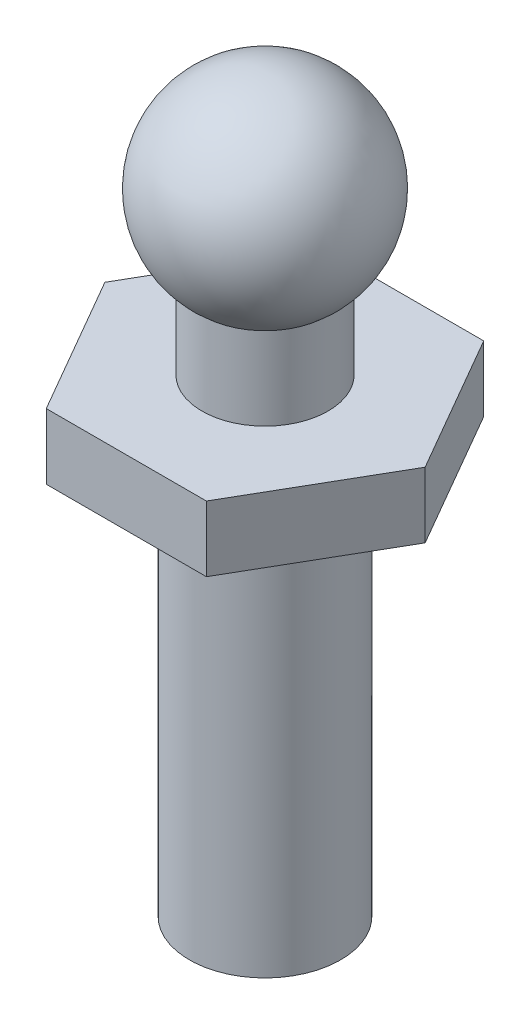
from build123d import *

# Parameters (mm, degrees)
BOSS_EXTRU_1_DEPTH = 1.3


with BuildPart() as part:
    # Esquisse1 → Révolution1 (revolve)
    with BuildSketch(Plane.XY, mode=Mode.PRIVATE) as r_volution1_sk:
        with BuildLine():
            Line((0, 2), (0, -12.5))
            Line((0, -12.5), (1.5, -12.5))
            Line((1.5, -12.5), (1.5, -4.5))
            Line((1.5, -4.5), (2.75, -4.5))
            Line((2.75, -4.5), (2.75, -3.2))
            Line((2.75, -3.2), (1.25, -3.2))
            Line((1.25, -3.2), (1.25, -1.5612495))
            ThreePointArc((1.25, -1.5612495), (1.887127314, 0.662382443), (0, 2))
        make_face()
    revolve(r_volution1_sk.sketch.rotate(Axis((0, 0, 0), (0, 1, 0)), 90), axis=Axis((0, 0, 0), (0, 1, 0)))

    # Esquisse2 → Boss.-Extru.1 (add)
    with BuildSketch(Plane(origin=(0, -3.2, 0), x_dir=(1, 0, 0), z_dir=(0, 1, 0))):
        Polygon((1.58771324, 2.75), (-1.58771324, 2.75), (-3.175426481, 0), (-1.58771324, -2.75), (1.58771324, -2.75), (3.175426481, 0), align=None)
    extrude(amount=-BOSS_EXTRU_1_DEPTH)


solid = part.part
